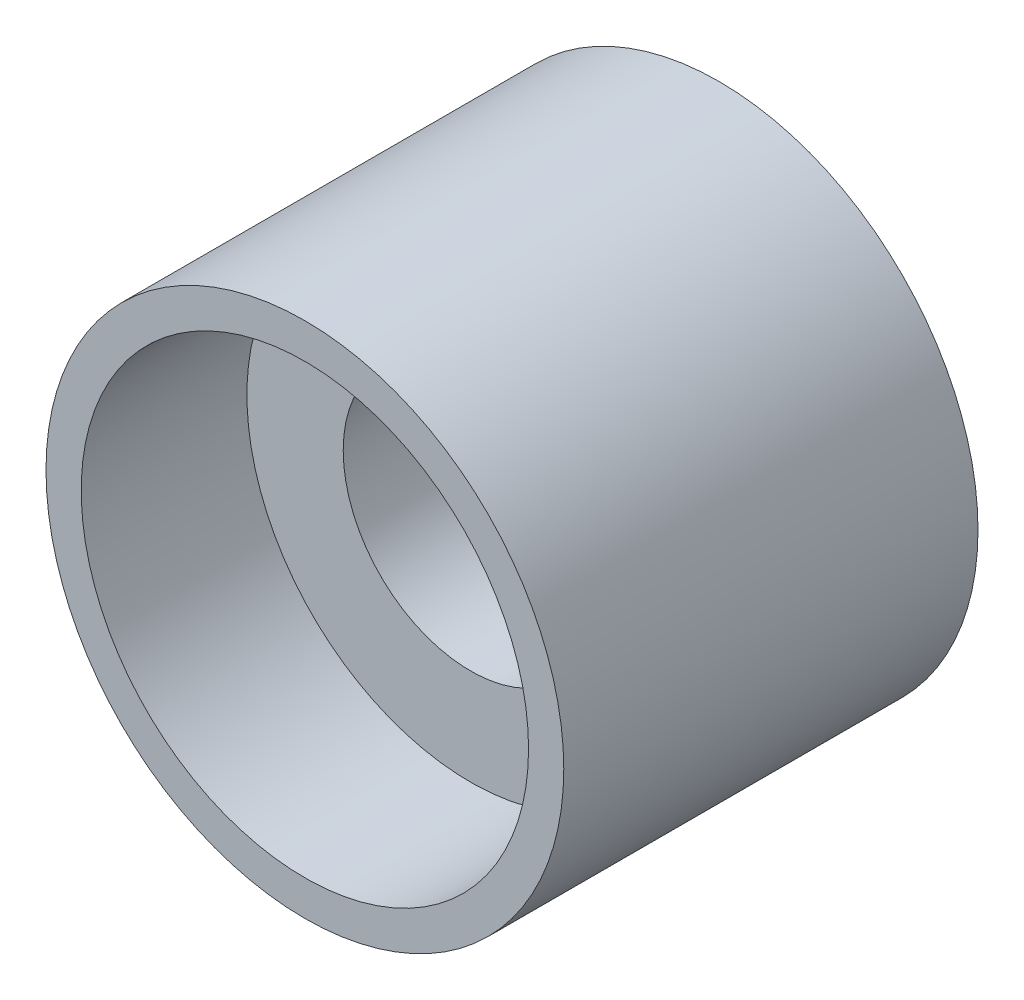
from build123d import *

# Parameters (mm, degrees)
SKETCH1_R           = 12.5
SKETCH1_R_2         = 6.15
BOSS_EXTRUDE1_DEPTH = 20
SKETCH2_R           = 10.8
CUT_EXTRUDE1_DEPTH  = 8


with BuildPart() as part:
    # Sketch1 → Boss-Extrude1 (new body)
    with BuildSketch(Plane.XY):
        Circle(SKETCH1_R)
        Circle(SKETCH1_R_2, mode=Mode.SUBTRACT)
    extrude(amount=BOSS_EXTRUDE1_DEPTH)

    # Sketch2 → Cut-Extrude1 (cut)
    with BuildSketch(Plane.XY.offset(20)):
        Circle(SKETCH2_R)
    extrude(amount=-CUT_EXTRUDE1_DEPTH, mode=Mode.SUBTRACT)


solid = part.part
